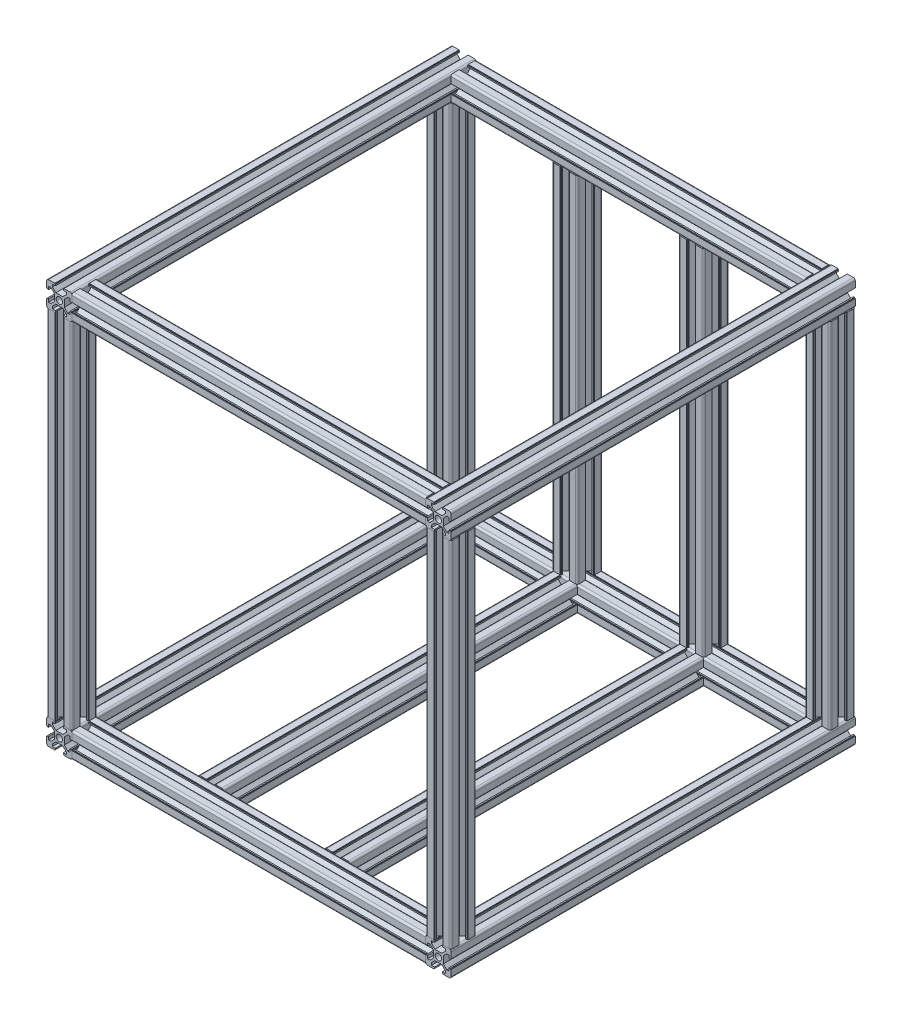
from build123d import *

# Parameters (mm, degrees)
F_20_X_20_X_R1_5_1_DEPTH      = 310
F_20_X_20_X_R1_5_1_DEPTH_BACK = 10
SKETCH11_R                    = 2.5
SKETCH11_ON_SEGMENT_2_R       = 2.5
F_20_X_20_X_R1_5_1_2_DEPTH    = 320
SKETCH11_ON_SEGMENT_3_R       = 2.5
F_20_X_20_X_R1_5_1_3_DEPTH    = 320
SKETCH11_ON_SEGMENT_4_R       = 2.5
F_20_X_20_X_R1_5_1_4_DEPTH    = 320
SKETCH11_ON_SEGMENT_5_R       = 2.5
F_20_X_20_X_R1_5_1_5_DEPTH    = 302
SKETCH11_ON_SEGMENT_6_R       = 2.5
F_20_X_20_X_R1_5_1_6_DEPTH    = 302
SKETCH11_ON_SEGMENT_7_R       = 2.5
F_20_X_20_X_R1_5_1_7_DEPTH    = 302
SKETCH11_ON_SEGMENT_8_R       = 2.5
F_20_X_20_X_R1_5_1_8_DEPTH    = 302
SKETCH11_ON_SEGMENT_9_R       = 2.5
F_20_X_20_X_R1_5_1_9_DEPTH    = 302
SKETCH11_ON_SEGMENT_10_R      = 2.5
F_20_X_20_X_R1_5_1_10_DEPTH   = 302
SKETCH11_ON_SEGMENT_11_R      = 2.5
F_20_X_20_X_R1_5_1_11_DEPTH   = 302
SKETCH11_ON_SEGMENT_12_R      = 2.5
F_20_X_20_X_R1_5_1_12_DEPTH   = 302
SKETCH1_R                     = 2.5
F_20_X_20_X_R1_5_3_DEPTH      = 300
SKETCH1_ON_SEGMENT_2_R        = 2.5
F_20_X_20_X_R1_5_3_2_DEPTH    = 300
SKETCH13_R                    = 2.5
F_20_X_20_X_R1_5_7_DEPTH      = 300
SKETCH13_ON_SEGMENT_2_R       = 2.5
F_20_X_20_X_R1_5_7_2_DEPTH    = 300


with BuildPart() as part:
    # Sketch11 → 铝型材 20 X 20 X R1.5(1) (new, two sides: drawn at the far end of the back side and taken through both)
    with BuildSketch(Plane(origin=(0, 300, -300), x_dir=(1, 0, 0), z_dir=(0, 0, 1)).offset(-F_20_X_20_X_R1_5_1_DEPTH_BACK)):
        with BuildLine():
            Line((-3.6, 10), (-3.6, 9.5))
            Line((-3.6, 9.5), (-3.1, 9.5))
            Line((-3.1, 9.5), (-3.1, 8.5))
            Line((-3.1, 8.5), (-5.5, 8.5))
            Line((-5.5, 8.5), (-5.5, 6.65))
            Line((-5.5, 6.65), (-2.75, 3.9))
            Line((-2.75, 3.9), (2.75, 3.9))
            Line((2.75, 3.9), (5.5, 6.65))
            Line((5.5, 6.65), (5.5, 8.5))
            Line((5.5, 8.5), (3.1, 8.5))
            Line((3.1, 8.5), (3.1, 9.5))
            Line((3.1, 9.5), (3.6, 9.5))
            Line((3.6, 9.5), (3.6, 10))
            Line((3.6, 10), (8.5, 10))
            ThreePointArc((8.5, 10), (9.560660172, 9.560660172), (10, 8.5))
            Line((10, 8.5), (10, 3.6))
            Line((10, 3.6), (9.5, 3.6))
            Line((9.5, 3.6), (9.5, 3.1))
            Line((9.5, 3.1), (8.5, 3.1))
            Line((8.5, 3.1), (8.5, 5.5))
            Line((8.5, 5.5), (6.65, 5.5))
            Line((6.65, 5.5), (3.9, 2.75))
            Line((3.9, 2.75), (3.9, -2.75))
            Line((3.9, -2.75), (6.65, -5.5))
            Line((6.65, -5.5), (8.5, -5.5))
            Line((8.5, -5.5), (8.5, -3.1))
            Line((8.5, -3.1), (9.5, -3.1))
            Line((9.5, -3.1), (9.5, -3.6))
            Line((9.5, -3.6), (10, -3.6))
            Line((10, -3.6), (10, -8.5))
            ThreePointArc((10, -8.5), (9.560660172, -9.560660172), (8.5, -10))
            Line((8.5, -10), (3.6, -10))
            Line((3.6, -10), (3.6, -9.5))
            Line((3.6, -9.5), (3.1, -9.5))
            Line((3.1, -9.5), (3.1, -8.5))
            Line((3.1, -8.5), (5.5, -8.5))
            Line((5.5, -8.5), (5.5, -6.65))
            Line((5.5, -6.65), (2.75, -3.9))
            Line((2.75, -3.9), (-2.75, -3.9))
            Line((-2.75, -3.9), (-5.5, -6.65))
            Line((-5.5, -6.65), (-5.5, -8.5))
            Line((-5.5, -8.5), (-3.1, -8.5))
            Line((-3.1, -8.5), (-3.1, -9.5))
            Line((-3.1, -9.5), (-3.6, -9.5))
            Line((-3.6, -9.5), (-3.6, -10))
            Line((-3.6, -10), (-8.5, -10))
            ThreePointArc((-8.5, -10), (-9.560660172, -9.560660172), (-10, -8.5))
            Line((-10, -8.5), (-10, -3.6))
            Line((-10, -3.6), (-9.5, -3.6))
            Line((-9.5, -3.6), (-9.5, -3.1))
            Line((-9.5, -3.1), (-8.5, -3.1))
            Line((-8.5, -3.1), (-8.5, -5.5))
            Line((-8.5, -5.5), (-6.65, -5.5))
            Line((-6.65, -5.5), (-3.9, -2.75))
            Line((-3.9, -2.75), (-3.9, 2.75))
            Line((-3.9, 2.75), (-6.65, 5.5))
            Line((-6.65, 5.5), (-8.5, 5.5))
            Line((-8.5, 5.5), (-8.5, 3.1))
            Line((-8.5, 3.1), (-9.5, 3.1))
            Line((-9.5, 3.1), (-9.5, 3.6))
            Line((-9.5, 3.6), (-10, 3.6))
            Line((-10, 3.6), (-10, 8.5))
            ThreePointArc((-10, 8.5), (-9.560660172, 9.560660172), (-8.5, 10))
            Line((-8.5, 10), (-3.6, 10))
        make_face()
        Circle(SKETCH11_R, mode=Mode.SUBTRACT)
    extrude(amount=F_20_X_20_X_R1_5_1_DEPTH + F_20_X_20_X_R1_5_1_DEPTH_BACK)


with BuildPart() as body_2:
    # Sketch11 on segment 2 (carried to segment 2) → 20 X 20 X R1.5_1 2 (new body)
    with BuildSketch(Plane(origin=(300, 0, -310), x_dir=(1, 0, 0), z_dir=(0, 0, 1))):
        with BuildLine():
            Line((-3.6, 10), (-3.6, 9.5))
            Line((-3.6, 9.5), (-3.1, 9.5))
            Line((-3.1, 9.5), (-3.1, 8.5))
            Line((-3.1, 8.5), (-5.5, 8.5))
            Line((-5.5, 8.5), (-5.5, 6.65))
            Line((-5.5, 6.65), (-2.75, 3.9))
            Line((-2.75, 3.9), (2.75, 3.9))
            Line((2.75, 3.9), (5.5, 6.65))
            Line((5.5, 6.65), (5.5, 8.5))
            Line((5.5, 8.5), (3.1, 8.5))
            Line((3.1, 8.5), (3.1, 9.5))
            Line((3.1, 9.5), (3.6, 9.5))
            Line((3.6, 9.5), (3.6, 10))
            Line((3.6, 10), (8.5, 10))
            ThreePointArc((8.5, 10), (9.560660172, 9.560660172), (10, 8.5))
            Line((10, 8.5), (10, 3.6))
            Line((10, 3.6), (9.5, 3.6))
            Line((9.5, 3.6), (9.5, 3.1))
            Line((9.5, 3.1), (8.5, 3.1))
            Line((8.5, 3.1), (8.5, 5.5))
            Line((8.5, 5.5), (6.65, 5.5))
            Line((6.65, 5.5), (3.9, 2.75))
            Line((3.9, 2.75), (3.9, -2.75))
            Line((3.9, -2.75), (6.65, -5.5))
            Line((6.65, -5.5), (8.5, -5.5))
            Line((8.5, -5.5), (8.5, -3.1))
            Line((8.5, -3.1), (9.5, -3.1))
            Line((9.5, -3.1), (9.5, -3.6))
            Line((9.5, -3.6), (10, -3.6))
            Line((10, -3.6), (10, -8.5))
            ThreePointArc((10, -8.5), (9.560660172, -9.560660172), (8.5, -10))
            Line((8.5, -10), (3.6, -10))
            Line((3.6, -10), (3.6, -9.5))
            Line((3.6, -9.5), (3.1, -9.5))
            Line((3.1, -9.5), (3.1, -8.5))
            Line((3.1, -8.5), (5.5, -8.5))
            Line((5.5, -8.5), (5.5, -6.65))
            Line((5.5, -6.65), (2.75, -3.9))
            Line((2.75, -3.9), (-2.75, -3.9))
            Line((-2.75, -3.9), (-5.5, -6.65))
            Line((-5.5, -6.65), (-5.5, -8.5))
            Line((-5.5, -8.5), (-3.1, -8.5))
            Line((-3.1, -8.5), (-3.1, -9.5))
            Line((-3.1, -9.5), (-3.6, -9.5))
            Line((-3.6, -9.5), (-3.6, -10))
            Line((-3.6, -10), (-8.5, -10))
            ThreePointArc((-8.5, -10), (-9.560660172, -9.560660172), (-10, -8.5))
            Line((-10, -8.5), (-10, -3.6))
            Line((-10, -3.6), (-9.5, -3.6))
            Line((-9.5, -3.6), (-9.5, -3.1))
            Line((-9.5, -3.1), (-8.5, -3.1))
            Line((-8.5, -3.1), (-8.5, -5.5))
            Line((-8.5, -5.5), (-6.65, -5.5))
            Line((-6.65, -5.5), (-3.9, -2.75))
            Line((-3.9, -2.75), (-3.9, 2.75))
            Line((-3.9, 2.75), (-6.65, 5.5))
            Line((-6.65, 5.5), (-8.5, 5.5))
            Line((-8.5, 5.5), (-8.5, 3.1))
            Line((-8.5, 3.1), (-9.5, 3.1))
            Line((-9.5, 3.1), (-9.5, 3.6))
            Line((-9.5, 3.6), (-10, 3.6))
            Line((-10, 3.6), (-10, 8.5))
            ThreePointArc((-10, 8.5), (-9.560660172, 9.560660172), (-8.5, 10))
            Line((-8.5, 10), (-3.6, 10))
        make_face()
        Circle(SKETCH11_ON_SEGMENT_2_R, mode=Mode.SUBTRACT)
    extrude(amount=F_20_X_20_X_R1_5_1_2_DEPTH)


with BuildPart() as body_3:
    # Sketch11 on segment 3 (carried to segment 3) → 20 X 20 X R1.5_1 3 (new body)
    with BuildSketch(Plane.XY.offset(-310)):
        with BuildLine():
            Line((-3.6, 10), (-3.6, 9.5))
            Line((-3.6, 9.5), (-3.1, 9.5))
            Line((-3.1, 9.5), (-3.1, 8.5))
            Line((-3.1, 8.5), (-5.5, 8.5))
            Line((-5.5, 8.5), (-5.5, 6.65))
            Line((-5.5, 6.65), (-2.75, 3.9))
            Line((-2.75, 3.9), (2.75, 3.9))
            Line((2.75, 3.9), (5.5, 6.65))
            Line((5.5, 6.65), (5.5, 8.5))
            Line((5.5, 8.5), (3.1, 8.5))
            Line((3.1, 8.5), (3.1, 9.5))
            Line((3.1, 9.5), (3.6, 9.5))
            Line((3.6, 9.5), (3.6, 10))
            Line((3.6, 10), (8.5, 10))
            ThreePointArc((8.5, 10), (9.560660172, 9.560660172), (10, 8.5))
            Line((10, 8.5), (10, 3.6))
            Line((10, 3.6), (9.5, 3.6))
            Line((9.5, 3.6), (9.5, 3.1))
            Line((9.5, 3.1), (8.5, 3.1))
            Line((8.5, 3.1), (8.5, 5.5))
            Line((8.5, 5.5), (6.65, 5.5))
            Line((6.65, 5.5), (3.9, 2.75))
            Line((3.9, 2.75), (3.9, -2.75))
            Line((3.9, -2.75), (6.65, -5.5))
            Line((6.65, -5.5), (8.5, -5.5))
            Line((8.5, -5.5), (8.5, -3.1))
            Line((8.5, -3.1), (9.5, -3.1))
            Line((9.5, -3.1), (9.5, -3.6))
            Line((9.5, -3.6), (10, -3.6))
            Line((10, -3.6), (10, -8.5))
            ThreePointArc((10, -8.5), (9.560660172, -9.560660172), (8.5, -10))
            Line((8.5, -10), (3.6, -10))
            Line((3.6, -10), (3.6, -9.5))
            Line((3.6, -9.5), (3.1, -9.5))
            Line((3.1, -9.5), (3.1, -8.5))
            Line((3.1, -8.5), (5.5, -8.5))
            Line((5.5, -8.5), (5.5, -6.65))
            Line((5.5, -6.65), (2.75, -3.9))
            Line((2.75, -3.9), (-2.75, -3.9))
            Line((-2.75, -3.9), (-5.5, -6.65))
            Line((-5.5, -6.65), (-5.5, -8.5))
            Line((-5.5, -8.5), (-3.1, -8.5))
            Line((-3.1, -8.5), (-3.1, -9.5))
            Line((-3.1, -9.5), (-3.6, -9.5))
            Line((-3.6, -9.5), (-3.6, -10))
            Line((-3.6, -10), (-8.5, -10))
            ThreePointArc((-8.5, -10), (-9.560660172, -9.560660172), (-10, -8.5))
            Line((-10, -8.5), (-10, -3.6))
            Line((-10, -3.6), (-9.5, -3.6))
            Line((-9.5, -3.6), (-9.5, -3.1))
            Line((-9.5, -3.1), (-8.5, -3.1))
            Line((-8.5, -3.1), (-8.5, -5.5))
            Line((-8.5, -5.5), (-6.65, -5.5))
            Line((-6.65, -5.5), (-3.9, -2.75))
            Line((-3.9, -2.75), (-3.9, 2.75))
            Line((-3.9, 2.75), (-6.65, 5.5))
            Line((-6.65, 5.5), (-8.5, 5.5))
            Line((-8.5, 5.5), (-8.5, 3.1))
            Line((-8.5, 3.1), (-9.5, 3.1))
            Line((-9.5, 3.1), (-9.5, 3.6))
            Line((-9.5, 3.6), (-10, 3.6))
            Line((-10, 3.6), (-10, 8.5))
            ThreePointArc((-10, 8.5), (-9.560660172, 9.560660172), (-8.5, 10))
            Line((-8.5, 10), (-3.6, 10))
        make_face()
        Circle(SKETCH11_ON_SEGMENT_3_R, mode=Mode.SUBTRACT)
    extrude(amount=F_20_X_20_X_R1_5_1_3_DEPTH)


with BuildPart() as body_4:
    # Sketch11 on segment 4 (carried to segment 4) → 20 X 20 X R1.5_1 4 (new body)
    with BuildSketch(Plane(origin=(300, 300, -310), x_dir=(1, 0, 0), z_dir=(0, 0, 1))):
        with BuildLine():
            Line((-3.6, 10), (-3.6, 9.5))
            Line((-3.6, 9.5), (-3.1, 9.5))
            Line((-3.1, 9.5), (-3.1, 8.5))
            Line((-3.1, 8.5), (-5.5, 8.5))
            Line((-5.5, 8.5), (-5.5, 6.65))
            Line((-5.5, 6.65), (-2.75, 3.9))
            Line((-2.75, 3.9), (2.75, 3.9))
            Line((2.75, 3.9), (5.5, 6.65))
            Line((5.5, 6.65), (5.5, 8.5))
            Line((5.5, 8.5), (3.1, 8.5))
            Line((3.1, 8.5), (3.1, 9.5))
            Line((3.1, 9.5), (3.6, 9.5))
            Line((3.6, 9.5), (3.6, 10))
            Line((3.6, 10), (8.5, 10))
            ThreePointArc((8.5, 10), (9.560660172, 9.560660172), (10, 8.5))
            Line((10, 8.5), (10, 3.6))
            Line((10, 3.6), (9.5, 3.6))
            Line((9.5, 3.6), (9.5, 3.1))
            Line((9.5, 3.1), (8.5, 3.1))
            Line((8.5, 3.1), (8.5, 5.5))
            Line((8.5, 5.5), (6.65, 5.5))
            Line((6.65, 5.5), (3.9, 2.75))
            Line((3.9, 2.75), (3.9, -2.75))
            Line((3.9, -2.75), (6.65, -5.5))
            Line((6.65, -5.5), (8.5, -5.5))
            Line((8.5, -5.5), (8.5, -3.1))
            Line((8.5, -3.1), (9.5, -3.1))
            Line((9.5, -3.1), (9.5, -3.6))
            Line((9.5, -3.6), (10, -3.6))
            Line((10, -3.6), (10, -8.5))
            ThreePointArc((10, -8.5), (9.560660172, -9.560660172), (8.5, -10))
            Line((8.5, -10), (3.6, -10))
            Line((3.6, -10), (3.6, -9.5))
            Line((3.6, -9.5), (3.1, -9.5))
            Line((3.1, -9.5), (3.1, -8.5))
            Line((3.1, -8.5), (5.5, -8.5))
            Line((5.5, -8.5), (5.5, -6.65))
            Line((5.5, -6.65), (2.75, -3.9))
            Line((2.75, -3.9), (-2.75, -3.9))
            Line((-2.75, -3.9), (-5.5, -6.65))
            Line((-5.5, -6.65), (-5.5, -8.5))
            Line((-5.5, -8.5), (-3.1, -8.5))
            Line((-3.1, -8.5), (-3.1, -9.5))
            Line((-3.1, -9.5), (-3.6, -9.5))
            Line((-3.6, -9.5), (-3.6, -10))
            Line((-3.6, -10), (-8.5, -10))
            ThreePointArc((-8.5, -10), (-9.560660172, -9.560660172), (-10, -8.5))
            Line((-10, -8.5), (-10, -3.6))
            Line((-10, -3.6), (-9.5, -3.6))
            Line((-9.5, -3.6), (-9.5, -3.1))
            Line((-9.5, -3.1), (-8.5, -3.1))
            Line((-8.5, -3.1), (-8.5, -5.5))
            Line((-8.5, -5.5), (-6.65, -5.5))
            Line((-6.65, -5.5), (-3.9, -2.75))
            Line((-3.9, -2.75), (-3.9, 2.75))
            Line((-3.9, 2.75), (-6.65, 5.5))
            Line((-6.65, 5.5), (-8.5, 5.5))
            Line((-8.5, 5.5), (-8.5, 3.1))
            Line((-8.5, 3.1), (-9.5, 3.1))
            Line((-9.5, 3.1), (-9.5, 3.6))
            Line((-9.5, 3.6), (-10, 3.6))
            Line((-10, 3.6), (-10, 8.5))
            ThreePointArc((-10, 8.5), (-9.560660172, 9.560660172), (-8.5, 10))
            Line((-8.5, 10), (-3.6, 10))
        make_face()
        Circle(SKETCH11_ON_SEGMENT_4_R, mode=Mode.SUBTRACT)
    extrude(amount=F_20_X_20_X_R1_5_1_4_DEPTH)


with BuildPart() as body_5:
    # Sketch11 on segment 5 (carried to segment 5) → 20 X 20 X R1.5_1 5 (new body)
    with BuildSketch(Plane(origin=(300, -1, 0), x_dir=(1, 0, 0), z_dir=(0, 1, 0))):
        with BuildLine():
            Line((-3.6, 10), (-3.6, 9.5))
            Line((-3.6, 9.5), (-3.1, 9.5))
            Line((-3.1, 9.5), (-3.1, 8.5))
            Line((-3.1, 8.5), (-5.5, 8.5))
            Line((-5.5, 8.5), (-5.5, 6.65))
            Line((-5.5, 6.65), (-2.75, 3.9))
            Line((-2.75, 3.9), (2.75, 3.9))
            Line((2.75, 3.9), (5.5, 6.65))
            Line((5.5, 6.65), (5.5, 8.5))
            Line((5.5, 8.5), (3.1, 8.5))
            Line((3.1, 8.5), (3.1, 9.5))
            Line((3.1, 9.5), (3.6, 9.5))
            Line((3.6, 9.5), (3.6, 10))
            Line((3.6, 10), (8.5, 10))
            ThreePointArc((8.5, 10), (9.560660172, 9.560660172), (10, 8.5))
            Line((10, 8.5), (10, 3.6))
            Line((10, 3.6), (9.5, 3.6))
            Line((9.5, 3.6), (9.5, 3.1))
            Line((9.5, 3.1), (8.5, 3.1))
            Line((8.5, 3.1), (8.5, 5.5))
            Line((8.5, 5.5), (6.65, 5.5))
            Line((6.65, 5.5), (3.9, 2.75))
            Line((3.9, 2.75), (3.9, -2.75))
            Line((3.9, -2.75), (6.65, -5.5))
            Line((6.65, -5.5), (8.5, -5.5))
            Line((8.5, -5.5), (8.5, -3.1))
            Line((8.5, -3.1), (9.5, -3.1))
            Line((9.5, -3.1), (9.5, -3.6))
            Line((9.5, -3.6), (10, -3.6))
            Line((10, -3.6), (10, -8.5))
            ThreePointArc((10, -8.5), (9.560660172, -9.560660172), (8.5, -10))
            Line((8.5, -10), (3.6, -10))
            Line((3.6, -10), (3.6, -9.5))
            Line((3.6, -9.5), (3.1, -9.5))
            Line((3.1, -9.5), (3.1, -8.5))
            Line((3.1, -8.5), (5.5, -8.5))
            Line((5.5, -8.5), (5.5, -6.65))
            Line((5.5, -6.65), (2.75, -3.9))
            Line((2.75, -3.9), (-2.75, -3.9))
            Line((-2.75, -3.9), (-5.5, -6.65))
            Line((-5.5, -6.65), (-5.5, -8.5))
            Line((-5.5, -8.5), (-3.1, -8.5))
            Line((-3.1, -8.5), (-3.1, -9.5))
            Line((-3.1, -9.5), (-3.6, -9.5))
            Line((-3.6, -9.5), (-3.6, -10))
            Line((-3.6, -10), (-8.5, -10))
            ThreePointArc((-8.5, -10), (-9.560660172, -9.560660172), (-10, -8.5))
            Line((-10, -8.5), (-10, -3.6))
            Line((-10, -3.6), (-9.5, -3.6))
            Line((-9.5, -3.6), (-9.5, -3.1))
            Line((-9.5, -3.1), (-8.5, -3.1))
            Line((-8.5, -3.1), (-8.5, -5.5))
            Line((-8.5, -5.5), (-6.65, -5.5))
            Line((-6.65, -5.5), (-3.9, -2.75))
            Line((-3.9, -2.75), (-3.9, 2.75))
            Line((-3.9, 2.75), (-6.65, 5.5))
            Line((-6.65, 5.5), (-8.5, 5.5))
            Line((-8.5, 5.5), (-8.5, 3.1))
            Line((-8.5, 3.1), (-9.5, 3.1))
            Line((-9.5, 3.1), (-9.5, 3.6))
            Line((-9.5, 3.6), (-10, 3.6))
            Line((-10, 3.6), (-10, 8.5))
            ThreePointArc((-10, 8.5), (-9.560660172, 9.560660172), (-8.5, 10))
            Line((-8.5, 10), (-3.6, 10))
        make_face()
        Circle(SKETCH11_ON_SEGMENT_5_R, mode=Mode.SUBTRACT)
    extrude(amount=F_20_X_20_X_R1_5_1_5_DEPTH)

    # 20 X 20 X R1.5_1 5 end butt 1
    split(bisect_by=Plane(origin=(300, 10, 0), x_dir=(-1, 0, 0), z_dir=(0, 1, 0)), keep=Keep.TOP)

    # 20 X 20 X R1.5_1 5 end butt 2
    split(bisect_by=Plane(origin=(300, 290, 0), x_dir=(1, 0, 0), z_dir=(0, -1, 0)), keep=Keep.TOP)


with BuildPart() as body_6:
    # Sketch11 on segment 6 (carried to segment 6) → 20 X 20 X R1.5_1 6 (new body)
    with BuildSketch(Plane(origin=(-1, 0, 0), x_dir=(0, 0, -1), z_dir=(1, 0, 0))):
        with BuildLine():
            Line((-3.6, 10), (-3.6, 9.5))
            Line((-3.6, 9.5), (-3.1, 9.5))
            Line((-3.1, 9.5), (-3.1, 8.5))
            Line((-3.1, 8.5), (-5.5, 8.5))
            Line((-5.5, 8.5), (-5.5, 6.65))
            Line((-5.5, 6.65), (-2.75, 3.9))
            Line((-2.75, 3.9), (2.75, 3.9))
            Line((2.75, 3.9), (5.5, 6.65))
            Line((5.5, 6.65), (5.5, 8.5))
            Line((5.5, 8.5), (3.1, 8.5))
            Line((3.1, 8.5), (3.1, 9.5))
            Line((3.1, 9.5), (3.6, 9.5))
            Line((3.6, 9.5), (3.6, 10))
            Line((3.6, 10), (8.5, 10))
            ThreePointArc((8.5, 10), (9.560660172, 9.560660172), (10, 8.5))
            Line((10, 8.5), (10, 3.6))
            Line((10, 3.6), (9.5, 3.6))
            Line((9.5, 3.6), (9.5, 3.1))
            Line((9.5, 3.1), (8.5, 3.1))
            Line((8.5, 3.1), (8.5, 5.5))
            Line((8.5, 5.5), (6.65, 5.5))
            Line((6.65, 5.5), (3.9, 2.75))
            Line((3.9, 2.75), (3.9, -2.75))
            Line((3.9, -2.75), (6.65, -5.5))
            Line((6.65, -5.5), (8.5, -5.5))
            Line((8.5, -5.5), (8.5, -3.1))
            Line((8.5, -3.1), (9.5, -3.1))
            Line((9.5, -3.1), (9.5, -3.6))
            Line((9.5, -3.6), (10, -3.6))
            Line((10, -3.6), (10, -8.5))
            ThreePointArc((10, -8.5), (9.560660172, -9.560660172), (8.5, -10))
            Line((8.5, -10), (3.6, -10))
            Line((3.6, -10), (3.6, -9.5))
            Line((3.6, -9.5), (3.1, -9.5))
            Line((3.1, -9.5), (3.1, -8.5))
            Line((3.1, -8.5), (5.5, -8.5))
            Line((5.5, -8.5), (5.5, -6.65))
            Line((5.5, -6.65), (2.75, -3.9))
            Line((2.75, -3.9), (-2.75, -3.9))
            Line((-2.75, -3.9), (-5.5, -6.65))
            Line((-5.5, -6.65), (-5.5, -8.5))
            Line((-5.5, -8.5), (-3.1, -8.5))
            Line((-3.1, -8.5), (-3.1, -9.5))
            Line((-3.1, -9.5), (-3.6, -9.5))
            Line((-3.6, -9.5), (-3.6, -10))
            Line((-3.6, -10), (-8.5, -10))
            ThreePointArc((-8.5, -10), (-9.560660172, -9.560660172), (-10, -8.5))
            Line((-10, -8.5), (-10, -3.6))
            Line((-10, -3.6), (-9.5, -3.6))
            Line((-9.5, -3.6), (-9.5, -3.1))
            Line((-9.5, -3.1), (-8.5, -3.1))
            Line((-8.5, -3.1), (-8.5, -5.5))
            Line((-8.5, -5.5), (-6.65, -5.5))
            Line((-6.65, -5.5), (-3.9, -2.75))
            Line((-3.9, -2.75), (-3.9, 2.75))
            Line((-3.9, 2.75), (-6.65, 5.5))
            Line((-6.65, 5.5), (-8.5, 5.5))
            Line((-8.5, 5.5), (-8.5, 3.1))
            Line((-8.5, 3.1), (-9.5, 3.1))
            Line((-9.5, 3.1), (-9.5, 3.6))
            Line((-9.5, 3.6), (-10, 3.6))
            Line((-10, 3.6), (-10, 8.5))
            ThreePointArc((-10, 8.5), (-9.560660172, 9.560660172), (-8.5, 10))
            Line((-8.5, 10), (-3.6, 10))
        make_face()
        Circle(SKETCH11_ON_SEGMENT_6_R, mode=Mode.SUBTRACT)
    extrude(amount=F_20_X_20_X_R1_5_1_6_DEPTH)

    # 20 X 20 X R1.5_1 6 end butt 1
    split(bisect_by=Plane.YZ.offset(10), keep=Keep.TOP)

    # 20 X 20 X R1.5_1 6 end butt 2
    split(bisect_by=Plane(origin=(290, 0, 0), x_dir=(0, -1, 0), z_dir=(-1, 0, 0)), keep=Keep.TOP)


with BuildPart() as body_7:
    # Sketch11 on segment 7 (carried to segment 7) → 20 X 20 X R1.5_1 7 (new body)
    with BuildSketch(Plane.XZ.offset(-301)):
        with BuildLine():
            Line((-3.6, 10), (-3.6, 9.5))
            Line((-3.6, 9.5), (-3.1, 9.5))
            Line((-3.1, 9.5), (-3.1, 8.5))
            Line((-3.1, 8.5), (-5.5, 8.5))
            Line((-5.5, 8.5), (-5.5, 6.65))
            Line((-5.5, 6.65), (-2.75, 3.9))
            Line((-2.75, 3.9), (2.75, 3.9))
            Line((2.75, 3.9), (5.5, 6.65))
            Line((5.5, 6.65), (5.5, 8.5))
            Line((5.5, 8.5), (3.1, 8.5))
            Line((3.1, 8.5), (3.1, 9.5))
            Line((3.1, 9.5), (3.6, 9.5))
            Line((3.6, 9.5), (3.6, 10))
            Line((3.6, 10), (8.5, 10))
            ThreePointArc((8.5, 10), (9.560660172, 9.560660172), (10, 8.5))
            Line((10, 8.5), (10, 3.6))
            Line((10, 3.6), (9.5, 3.6))
            Line((9.5, 3.6), (9.5, 3.1))
            Line((9.5, 3.1), (8.5, 3.1))
            Line((8.5, 3.1), (8.5, 5.5))
            Line((8.5, 5.5), (6.65, 5.5))
            Line((6.65, 5.5), (3.9, 2.75))
            Line((3.9, 2.75), (3.9, -2.75))
            Line((3.9, -2.75), (6.65, -5.5))
            Line((6.65, -5.5), (8.5, -5.5))
            Line((8.5, -5.5), (8.5, -3.1))
            Line((8.5, -3.1), (9.5, -3.1))
            Line((9.5, -3.1), (9.5, -3.6))
            Line((9.5, -3.6), (10, -3.6))
            Line((10, -3.6), (10, -8.5))
            ThreePointArc((10, -8.5), (9.560660172, -9.560660172), (8.5, -10))
            Line((8.5, -10), (3.6, -10))
            Line((3.6, -10), (3.6, -9.5))
            Line((3.6, -9.5), (3.1, -9.5))
            Line((3.1, -9.5), (3.1, -8.5))
            Line((3.1, -8.5), (5.5, -8.5))
            Line((5.5, -8.5), (5.5, -6.65))
            Line((5.5, -6.65), (2.75, -3.9))
            Line((2.75, -3.9), (-2.75, -3.9))
            Line((-2.75, -3.9), (-5.5, -6.65))
            Line((-5.5, -6.65), (-5.5, -8.5))
            Line((-5.5, -8.5), (-3.1, -8.5))
            Line((-3.1, -8.5), (-3.1, -9.5))
            Line((-3.1, -9.5), (-3.6, -9.5))
            Line((-3.6, -9.5), (-3.6, -10))
            Line((-3.6, -10), (-8.5, -10))
            ThreePointArc((-8.5, -10), (-9.560660172, -9.560660172), (-10, -8.5))
            Line((-10, -8.5), (-10, -3.6))
            Line((-10, -3.6), (-9.5, -3.6))
            Line((-9.5, -3.6), (-9.5, -3.1))
            Line((-9.5, -3.1), (-8.5, -3.1))
            Line((-8.5, -3.1), (-8.5, -5.5))
            Line((-8.5, -5.5), (-6.65, -5.5))
            Line((-6.65, -5.5), (-3.9, -2.75))
            Line((-3.9, -2.75), (-3.9, 2.75))
            Line((-3.9, 2.75), (-6.65, 5.5))
            Line((-6.65, 5.5), (-8.5, 5.5))
            Line((-8.5, 5.5), (-8.5, 3.1))
            Line((-8.5, 3.1), (-9.5, 3.1))
            Line((-9.5, 3.1), (-9.5, 3.6))
            Line((-9.5, 3.6), (-10, 3.6))
            Line((-10, 3.6), (-10, 8.5))
            ThreePointArc((-10, 8.5), (-9.560660172, 9.560660172), (-8.5, 10))
            Line((-8.5, 10), (-3.6, 10))
        make_face()
        Circle(SKETCH11_ON_SEGMENT_7_R, mode=Mode.SUBTRACT)
    extrude(amount=F_20_X_20_X_R1_5_1_7_DEPTH)

    # 20 X 20 X R1.5_1 7 end butt 1
    split(bisect_by=Plane.XZ.offset(-290), keep=Keep.TOP)

    # 20 X 20 X R1.5_1 7 end butt 2
    split(bisect_by=Plane(origin=(0, 10, 0), x_dir=(-1, 0, 0), z_dir=(0, 1, 0)), keep=Keep.TOP)


with BuildPart() as body_8:
    # Sketch11 on segment 8 (carried to segment 8) → 20 X 20 X R1.5_1 8 (new body)
    with BuildSketch(Plane(origin=(301, 300, 0), x_dir=(0, 0, 1), z_dir=(-1, 0, 0))):
        with BuildLine():
            Line((-3.6, 10), (-3.6, 9.5))
            Line((-3.6, 9.5), (-3.1, 9.5))
            Line((-3.1, 9.5), (-3.1, 8.5))
            Line((-3.1, 8.5), (-5.5, 8.5))
            Line((-5.5, 8.5), (-5.5, 6.65))
            Line((-5.5, 6.65), (-2.75, 3.9))
            Line((-2.75, 3.9), (2.75, 3.9))
            Line((2.75, 3.9), (5.5, 6.65))
            Line((5.5, 6.65), (5.5, 8.5))
            Line((5.5, 8.5), (3.1, 8.5))
            Line((3.1, 8.5), (3.1, 9.5))
            Line((3.1, 9.5), (3.6, 9.5))
            Line((3.6, 9.5), (3.6, 10))
            Line((3.6, 10), (8.5, 10))
            ThreePointArc((8.5, 10), (9.560660172, 9.560660172), (10, 8.5))
            Line((10, 8.5), (10, 3.6))
            Line((10, 3.6), (9.5, 3.6))
            Line((9.5, 3.6), (9.5, 3.1))
            Line((9.5, 3.1), (8.5, 3.1))
            Line((8.5, 3.1), (8.5, 5.5))
            Line((8.5, 5.5), (6.65, 5.5))
            Line((6.65, 5.5), (3.9, 2.75))
            Line((3.9, 2.75), (3.9, -2.75))
            Line((3.9, -2.75), (6.65, -5.5))
            Line((6.65, -5.5), (8.5, -5.5))
            Line((8.5, -5.5), (8.5, -3.1))
            Line((8.5, -3.1), (9.5, -3.1))
            Line((9.5, -3.1), (9.5, -3.6))
            Line((9.5, -3.6), (10, -3.6))
            Line((10, -3.6), (10, -8.5))
            ThreePointArc((10, -8.5), (9.560660172, -9.560660172), (8.5, -10))
            Line((8.5, -10), (3.6, -10))
            Line((3.6, -10), (3.6, -9.5))
            Line((3.6, -9.5), (3.1, -9.5))
            Line((3.1, -9.5), (3.1, -8.5))
            Line((3.1, -8.5), (5.5, -8.5))
            Line((5.5, -8.5), (5.5, -6.65))
            Line((5.5, -6.65), (2.75, -3.9))
            Line((2.75, -3.9), (-2.75, -3.9))
            Line((-2.75, -3.9), (-5.5, -6.65))
            Line((-5.5, -6.65), (-5.5, -8.5))
            Line((-5.5, -8.5), (-3.1, -8.5))
            Line((-3.1, -8.5), (-3.1, -9.5))
            Line((-3.1, -9.5), (-3.6, -9.5))
            Line((-3.6, -9.5), (-3.6, -10))
            Line((-3.6, -10), (-8.5, -10))
            ThreePointArc((-8.5, -10), (-9.560660172, -9.560660172), (-10, -8.5))
            Line((-10, -8.5), (-10, -3.6))
            Line((-10, -3.6), (-9.5, -3.6))
            Line((-9.5, -3.6), (-9.5, -3.1))
            Line((-9.5, -3.1), (-8.5, -3.1))
            Line((-8.5, -3.1), (-8.5, -5.5))
            Line((-8.5, -5.5), (-6.65, -5.5))
            Line((-6.65, -5.5), (-3.9, -2.75))
            Line((-3.9, -2.75), (-3.9, 2.75))
            Line((-3.9, 2.75), (-6.65, 5.5))
            Line((-6.65, 5.5), (-8.5, 5.5))
            Line((-8.5, 5.5), (-8.5, 3.1))
            Line((-8.5, 3.1), (-9.5, 3.1))
            Line((-9.5, 3.1), (-9.5, 3.6))
            Line((-9.5, 3.6), (-10, 3.6))
            Line((-10, 3.6), (-10, 8.5))
            ThreePointArc((-10, 8.5), (-9.560660172, 9.560660172), (-8.5, 10))
            Line((-8.5, 10), (-3.6, 10))
        make_face()
        Circle(SKETCH11_ON_SEGMENT_8_R, mode=Mode.SUBTRACT)
    extrude(amount=F_20_X_20_X_R1_5_1_8_DEPTH)

    # 20 X 20 X R1.5_1 8 end butt 1
    split(bisect_by=Plane(origin=(290, 300, 0), x_dir=(0, -1, 0), z_dir=(-1, 0, 0)), keep=Keep.TOP)

    # 20 X 20 X R1.5_1 8 end butt 2
    split(bisect_by=Plane(origin=(10, 300, 0), x_dir=(0, 1, 0), z_dir=(1, 0, 0)), keep=Keep.TOP)


with BuildPart() as body_9:
    # Sketch11 on segment 9 (carried to segment 9) → 20 X 20 X R1.5_1 9 (new body)
    with BuildSketch(Plane(origin=(300, -1, -300), x_dir=(1, 0, 0), z_dir=(0, 1, 0))):
        with BuildLine():
            Line((-3.6, 10), (-3.6, 9.5))
            Line((-3.6, 9.5), (-3.1, 9.5))
            Line((-3.1, 9.5), (-3.1, 8.5))
            Line((-3.1, 8.5), (-5.5, 8.5))
            Line((-5.5, 8.5), (-5.5, 6.65))
            Line((-5.5, 6.65), (-2.75, 3.9))
            Line((-2.75, 3.9), (2.75, 3.9))
            Line((2.75, 3.9), (5.5, 6.65))
            Line((5.5, 6.65), (5.5, 8.5))
            Line((5.5, 8.5), (3.1, 8.5))
            Line((3.1, 8.5), (3.1, 9.5))
            Line((3.1, 9.5), (3.6, 9.5))
            Line((3.6, 9.5), (3.6, 10))
            Line((3.6, 10), (8.5, 10))
            ThreePointArc((8.5, 10), (9.560660172, 9.560660172), (10, 8.5))
            Line((10, 8.5), (10, 3.6))
            Line((10, 3.6), (9.5, 3.6))
            Line((9.5, 3.6), (9.5, 3.1))
            Line((9.5, 3.1), (8.5, 3.1))
            Line((8.5, 3.1), (8.5, 5.5))
            Line((8.5, 5.5), (6.65, 5.5))
            Line((6.65, 5.5), (3.9, 2.75))
            Line((3.9, 2.75), (3.9, -2.75))
            Line((3.9, -2.75), (6.65, -5.5))
            Line((6.65, -5.5), (8.5, -5.5))
            Line((8.5, -5.5), (8.5, -3.1))
            Line((8.5, -3.1), (9.5, -3.1))
            Line((9.5, -3.1), (9.5, -3.6))
            Line((9.5, -3.6), (10, -3.6))
            Line((10, -3.6), (10, -8.5))
            ThreePointArc((10, -8.5), (9.560660172, -9.560660172), (8.5, -10))
            Line((8.5, -10), (3.6, -10))
            Line((3.6, -10), (3.6, -9.5))
            Line((3.6, -9.5), (3.1, -9.5))
            Line((3.1, -9.5), (3.1, -8.5))
            Line((3.1, -8.5), (5.5, -8.5))
            Line((5.5, -8.5), (5.5, -6.65))
            Line((5.5, -6.65), (2.75, -3.9))
            Line((2.75, -3.9), (-2.75, -3.9))
            Line((-2.75, -3.9), (-5.5, -6.65))
            Line((-5.5, -6.65), (-5.5, -8.5))
            Line((-5.5, -8.5), (-3.1, -8.5))
            Line((-3.1, -8.5), (-3.1, -9.5))
            Line((-3.1, -9.5), (-3.6, -9.5))
            Line((-3.6, -9.5), (-3.6, -10))
            Line((-3.6, -10), (-8.5, -10))
            ThreePointArc((-8.5, -10), (-9.560660172, -9.560660172), (-10, -8.5))
            Line((-10, -8.5), (-10, -3.6))
            Line((-10, -3.6), (-9.5, -3.6))
            Line((-9.5, -3.6), (-9.5, -3.1))
            Line((-9.5, -3.1), (-8.5, -3.1))
            Line((-8.5, -3.1), (-8.5, -5.5))
            Line((-8.5, -5.5), (-6.65, -5.5))
            Line((-6.65, -5.5), (-3.9, -2.75))
            Line((-3.9, -2.75), (-3.9, 2.75))
            Line((-3.9, 2.75), (-6.65, 5.5))
            Line((-6.65, 5.5), (-8.5, 5.5))
            Line((-8.5, 5.5), (-8.5, 3.1))
            Line((-8.5, 3.1), (-9.5, 3.1))
            Line((-9.5, 3.1), (-9.5, 3.6))
            Line((-9.5, 3.6), (-10, 3.6))
            Line((-10, 3.6), (-10, 8.5))
            ThreePointArc((-10, 8.5), (-9.560660172, 9.560660172), (-8.5, 10))
            Line((-8.5, 10), (-3.6, 10))
        make_face()
        Circle(SKETCH11_ON_SEGMENT_9_R, mode=Mode.SUBTRACT)
    extrude(amount=F_20_X_20_X_R1_5_1_9_DEPTH)

    # 20 X 20 X R1.5_1 9 end butt 1
    split(bisect_by=Plane(origin=(300, 10, -300), x_dir=(-1, 0, 0), z_dir=(0, 1, 0)), keep=Keep.TOP)

    # 20 X 20 X R1.5_1 9 end butt 2
    split(bisect_by=Plane(origin=(300, 290, -300), x_dir=(1, 0, 0), z_dir=(0, -1, 0)), keep=Keep.TOP)


with BuildPart() as body_10:
    # Sketch11 on segment 10 (carried to segment 10) → 20 X 20 X R1.5_1 10 (new body)
    with BuildSketch(Plane(origin=(301, 300, -300), x_dir=(0, 0, 1), z_dir=(-1, 0, 0))):
        with BuildLine():
            Line((-3.6, 10), (-3.6, 9.5))
            Line((-3.6, 9.5), (-3.1, 9.5))
            Line((-3.1, 9.5), (-3.1, 8.5))
            Line((-3.1, 8.5), (-5.5, 8.5))
            Line((-5.5, 8.5), (-5.5, 6.65))
            Line((-5.5, 6.65), (-2.75, 3.9))
            Line((-2.75, 3.9), (2.75, 3.9))
            Line((2.75, 3.9), (5.5, 6.65))
            Line((5.5, 6.65), (5.5, 8.5))
            Line((5.5, 8.5), (3.1, 8.5))
            Line((3.1, 8.5), (3.1, 9.5))
            Line((3.1, 9.5), (3.6, 9.5))
            Line((3.6, 9.5), (3.6, 10))
            Line((3.6, 10), (8.5, 10))
            ThreePointArc((8.5, 10), (9.560660172, 9.560660172), (10, 8.5))
            Line((10, 8.5), (10, 3.6))
            Line((10, 3.6), (9.5, 3.6))
            Line((9.5, 3.6), (9.5, 3.1))
            Line((9.5, 3.1), (8.5, 3.1))
            Line((8.5, 3.1), (8.5, 5.5))
            Line((8.5, 5.5), (6.65, 5.5))
            Line((6.65, 5.5), (3.9, 2.75))
            Line((3.9, 2.75), (3.9, -2.75))
            Line((3.9, -2.75), (6.65, -5.5))
            Line((6.65, -5.5), (8.5, -5.5))
            Line((8.5, -5.5), (8.5, -3.1))
            Line((8.5, -3.1), (9.5, -3.1))
            Line((9.5, -3.1), (9.5, -3.6))
            Line((9.5, -3.6), (10, -3.6))
            Line((10, -3.6), (10, -8.5))
            ThreePointArc((10, -8.5), (9.560660172, -9.560660172), (8.5, -10))
            Line((8.5, -10), (3.6, -10))
            Line((3.6, -10), (3.6, -9.5))
            Line((3.6, -9.5), (3.1, -9.5))
            Line((3.1, -9.5), (3.1, -8.5))
            Line((3.1, -8.5), (5.5, -8.5))
            Line((5.5, -8.5), (5.5, -6.65))
            Line((5.5, -6.65), (2.75, -3.9))
            Line((2.75, -3.9), (-2.75, -3.9))
            Line((-2.75, -3.9), (-5.5, -6.65))
            Line((-5.5, -6.65), (-5.5, -8.5))
            Line((-5.5, -8.5), (-3.1, -8.5))
            Line((-3.1, -8.5), (-3.1, -9.5))
            Line((-3.1, -9.5), (-3.6, -9.5))
            Line((-3.6, -9.5), (-3.6, -10))
            Line((-3.6, -10), (-8.5, -10))
            ThreePointArc((-8.5, -10), (-9.560660172, -9.560660172), (-10, -8.5))
            Line((-10, -8.5), (-10, -3.6))
            Line((-10, -3.6), (-9.5, -3.6))
            Line((-9.5, -3.6), (-9.5, -3.1))
            Line((-9.5, -3.1), (-8.5, -3.1))
            Line((-8.5, -3.1), (-8.5, -5.5))
            Line((-8.5, -5.5), (-6.65, -5.5))
            Line((-6.65, -5.5), (-3.9, -2.75))
            Line((-3.9, -2.75), (-3.9, 2.75))
            Line((-3.9, 2.75), (-6.65, 5.5))
            Line((-6.65, 5.5), (-8.5, 5.5))
            Line((-8.5, 5.5), (-8.5, 3.1))
            Line((-8.5, 3.1), (-9.5, 3.1))
            Line((-9.5, 3.1), (-9.5, 3.6))
            Line((-9.5, 3.6), (-10, 3.6))
            Line((-10, 3.6), (-10, 8.5))
            ThreePointArc((-10, 8.5), (-9.560660172, 9.560660172), (-8.5, 10))
            Line((-8.5, 10), (-3.6, 10))
        make_face()
        Circle(SKETCH11_ON_SEGMENT_10_R, mode=Mode.SUBTRACT)
    extrude(amount=F_20_X_20_X_R1_5_1_10_DEPTH)

    # 20 X 20 X R1.5_1 10 end butt 1
    split(bisect_by=Plane(origin=(290, 300, -300), x_dir=(0, -1, 0), z_dir=(-1, 0, 0)), keep=Keep.TOP)

    # 20 X 20 X R1.5_1 10 end butt 2
    split(bisect_by=Plane(origin=(10, 300, -300), x_dir=(0, 1, 0), z_dir=(1, 0, 0)), keep=Keep.TOP)


with BuildPart() as body_11:
    # Sketch11 on segment 11 (carried to segment 11) → 20 X 20 X R1.5_1 11 (new body)
    with BuildSketch(Plane(origin=(0, 301, -300), x_dir=(1, 0, 0), z_dir=(0, -1, 0))):
        with BuildLine():
            Line((-3.6, 10), (-3.6, 9.5))
            Line((-3.6, 9.5), (-3.1, 9.5))
            Line((-3.1, 9.5), (-3.1, 8.5))
            Line((-3.1, 8.5), (-5.5, 8.5))
            Line((-5.5, 8.5), (-5.5, 6.65))
            Line((-5.5, 6.65), (-2.75, 3.9))
            Line((-2.75, 3.9), (2.75, 3.9))
            Line((2.75, 3.9), (5.5, 6.65))
            Line((5.5, 6.65), (5.5, 8.5))
            Line((5.5, 8.5), (3.1, 8.5))
            Line((3.1, 8.5), (3.1, 9.5))
            Line((3.1, 9.5), (3.6, 9.5))
            Line((3.6, 9.5), (3.6, 10))
            Line((3.6, 10), (8.5, 10))
            ThreePointArc((8.5, 10), (9.560660172, 9.560660172), (10, 8.5))
            Line((10, 8.5), (10, 3.6))
            Line((10, 3.6), (9.5, 3.6))
            Line((9.5, 3.6), (9.5, 3.1))
            Line((9.5, 3.1), (8.5, 3.1))
            Line((8.5, 3.1), (8.5, 5.5))
            Line((8.5, 5.5), (6.65, 5.5))
            Line((6.65, 5.5), (3.9, 2.75))
            Line((3.9, 2.75), (3.9, -2.75))
            Line((3.9, -2.75), (6.65, -5.5))
            Line((6.65, -5.5), (8.5, -5.5))
            Line((8.5, -5.5), (8.5, -3.1))
            Line((8.5, -3.1), (9.5, -3.1))
            Line((9.5, -3.1), (9.5, -3.6))
            Line((9.5, -3.6), (10, -3.6))
            Line((10, -3.6), (10, -8.5))
            ThreePointArc((10, -8.5), (9.560660172, -9.560660172), (8.5, -10))
            Line((8.5, -10), (3.6, -10))
            Line((3.6, -10), (3.6, -9.5))
            Line((3.6, -9.5), (3.1, -9.5))
            Line((3.1, -9.5), (3.1, -8.5))
            Line((3.1, -8.5), (5.5, -8.5))
            Line((5.5, -8.5), (5.5, -6.65))
            Line((5.5, -6.65), (2.75, -3.9))
            Line((2.75, -3.9), (-2.75, -3.9))
            Line((-2.75, -3.9), (-5.5, -6.65))
            Line((-5.5, -6.65), (-5.5, -8.5))
            Line((-5.5, -8.5), (-3.1, -8.5))
            Line((-3.1, -8.5), (-3.1, -9.5))
            Line((-3.1, -9.5), (-3.6, -9.5))
            Line((-3.6, -9.5), (-3.6, -10))
            Line((-3.6, -10), (-8.5, -10))
            ThreePointArc((-8.5, -10), (-9.560660172, -9.560660172), (-10, -8.5))
            Line((-10, -8.5), (-10, -3.6))
            Line((-10, -3.6), (-9.5, -3.6))
            Line((-9.5, -3.6), (-9.5, -3.1))
            Line((-9.5, -3.1), (-8.5, -3.1))
            Line((-8.5, -3.1), (-8.5, -5.5))
            Line((-8.5, -5.5), (-6.65, -5.5))
            Line((-6.65, -5.5), (-3.9, -2.75))
            Line((-3.9, -2.75), (-3.9, 2.75))
            Line((-3.9, 2.75), (-6.65, 5.5))
            Line((-6.65, 5.5), (-8.5, 5.5))
            Line((-8.5, 5.5), (-8.5, 3.1))
            Line((-8.5, 3.1), (-9.5, 3.1))
            Line((-9.5, 3.1), (-9.5, 3.6))
            Line((-9.5, 3.6), (-10, 3.6))
            Line((-10, 3.6), (-10, 8.5))
            ThreePointArc((-10, 8.5), (-9.560660172, 9.560660172), (-8.5, 10))
            Line((-8.5, 10), (-3.6, 10))
        make_face()
        Circle(SKETCH11_ON_SEGMENT_11_R, mode=Mode.SUBTRACT)
    extrude(amount=F_20_X_20_X_R1_5_1_11_DEPTH)

    # 20 X 20 X R1.5_1 11 end butt 1
    split(bisect_by=Plane(origin=(0, 290, -300), x_dir=(1, 0, 0), z_dir=(0, -1, 0)), keep=Keep.TOP)

    # 20 X 20 X R1.5_1 11 end butt 2
    split(bisect_by=Plane(origin=(0, 10, -300), x_dir=(-1, 0, 0), z_dir=(0, 1, 0)), keep=Keep.TOP)


with BuildPart() as body_12:
    # Sketch11 on segment 12 (carried to segment 12) → 20 X 20 X R1.5_1 12 (new body)
    with BuildSketch(Plane(origin=(-1, 0, -300), x_dir=(0, 0, -1), z_dir=(1, 0, 0))):
        with BuildLine():
            Line((-3.6, 10), (-3.6, 9.5))
            Line((-3.6, 9.5), (-3.1, 9.5))
            Line((-3.1, 9.5), (-3.1, 8.5))
            Line((-3.1, 8.5), (-5.5, 8.5))
            Line((-5.5, 8.5), (-5.5, 6.65))
            Line((-5.5, 6.65), (-2.75, 3.9))
            Line((-2.75, 3.9), (2.75, 3.9))
            Line((2.75, 3.9), (5.5, 6.65))
            Line((5.5, 6.65), (5.5, 8.5))
            Line((5.5, 8.5), (3.1, 8.5))
            Line((3.1, 8.5), (3.1, 9.5))
            Line((3.1, 9.5), (3.6, 9.5))
            Line((3.6, 9.5), (3.6, 10))
            Line((3.6, 10), (8.5, 10))
            ThreePointArc((8.5, 10), (9.560660172, 9.560660172), (10, 8.5))
            Line((10, 8.5), (10, 3.6))
            Line((10, 3.6), (9.5, 3.6))
            Line((9.5, 3.6), (9.5, 3.1))
            Line((9.5, 3.1), (8.5, 3.1))
            Line((8.5, 3.1), (8.5, 5.5))
            Line((8.5, 5.5), (6.65, 5.5))
            Line((6.65, 5.5), (3.9, 2.75))
            Line((3.9, 2.75), (3.9, -2.75))
            Line((3.9, -2.75), (6.65, -5.5))
            Line((6.65, -5.5), (8.5, -5.5))
            Line((8.5, -5.5), (8.5, -3.1))
            Line((8.5, -3.1), (9.5, -3.1))
            Line((9.5, -3.1), (9.5, -3.6))
            Line((9.5, -3.6), (10, -3.6))
            Line((10, -3.6), (10, -8.5))
            ThreePointArc((10, -8.5), (9.560660172, -9.560660172), (8.5, -10))
            Line((8.5, -10), (3.6, -10))
            Line((3.6, -10), (3.6, -9.5))
            Line((3.6, -9.5), (3.1, -9.5))
            Line((3.1, -9.5), (3.1, -8.5))
            Line((3.1, -8.5), (5.5, -8.5))
            Line((5.5, -8.5), (5.5, -6.65))
            Line((5.5, -6.65), (2.75, -3.9))
            Line((2.75, -3.9), (-2.75, -3.9))
            Line((-2.75, -3.9), (-5.5, -6.65))
            Line((-5.5, -6.65), (-5.5, -8.5))
            Line((-5.5, -8.5), (-3.1, -8.5))
            Line((-3.1, -8.5), (-3.1, -9.5))
            Line((-3.1, -9.5), (-3.6, -9.5))
            Line((-3.6, -9.5), (-3.6, -10))
            Line((-3.6, -10), (-8.5, -10))
            ThreePointArc((-8.5, -10), (-9.560660172, -9.560660172), (-10, -8.5))
            Line((-10, -8.5), (-10, -3.6))
            Line((-10, -3.6), (-9.5, -3.6))
            Line((-9.5, -3.6), (-9.5, -3.1))
            Line((-9.5, -3.1), (-8.5, -3.1))
            Line((-8.5, -3.1), (-8.5, -5.5))
            Line((-8.5, -5.5), (-6.65, -5.5))
            Line((-6.65, -5.5), (-3.9, -2.75))
            Line((-3.9, -2.75), (-3.9, 2.75))
            Line((-3.9, 2.75), (-6.65, 5.5))
            Line((-6.65, 5.5), (-8.5, 5.5))
            Line((-8.5, 5.5), (-8.5, 3.1))
            Line((-8.5, 3.1), (-9.5, 3.1))
            Line((-9.5, 3.1), (-9.5, 3.6))
            Line((-9.5, 3.6), (-10, 3.6))
            Line((-10, 3.6), (-10, 8.5))
            ThreePointArc((-10, 8.5), (-9.560660172, 9.560660172), (-8.5, 10))
            Line((-8.5, 10), (-3.6, 10))
        make_face()
        Circle(SKETCH11_ON_SEGMENT_12_R, mode=Mode.SUBTRACT)
    extrude(amount=F_20_X_20_X_R1_5_1_12_DEPTH)

    # 20 X 20 X R1.5_1 12 end butt 1
    split(bisect_by=Plane(origin=(10, 0, -300), x_dir=(0, 1, 0), z_dir=(1, 0, 0)), keep=Keep.TOP)

    # 20 X 20 X R1.5_1 12 end butt 2
    split(bisect_by=Plane(origin=(290, 0, -300), x_dir=(0, -1, 0), z_dir=(-1, 0, 0)), keep=Keep.TOP)


with BuildPart() as body_13:
    # Sketch1 → 铝型材 20 X 20 X R1.5(3) (new body)
    with BuildSketch(Plane(origin=(100, 300, -300), x_dir=(1, 0, 0), z_dir=(0, -1, 0))):
        with BuildLine():
            Line((-3.6, 10), (-3.6, 9.5))
            Line((-3.6, 9.5), (-3.1, 9.5))
            Line((-3.1, 9.5), (-3.1, 8.5))
            Line((-3.1, 8.5), (-5.5, 8.5))
            Line((-5.5, 8.5), (-5.5, 6.65))
            Line((-5.5, 6.65), (-2.75, 3.9))
            Line((-2.75, 3.9), (2.75, 3.9))
            Line((2.75, 3.9), (5.5, 6.65))
            Line((5.5, 6.65), (5.5, 8.5))
            Line((5.5, 8.5), (3.1, 8.5))
            Line((3.1, 8.5), (3.1, 9.5))
            Line((3.1, 9.5), (3.6, 9.5))
            Line((3.6, 9.5), (3.6, 10))
            Line((3.6, 10), (8.5, 10))
            ThreePointArc((8.5, 10), (9.560660172, 9.560660172), (10, 8.5))
            Line((10, 8.5), (10, 3.6))
            Line((10, 3.6), (9.5, 3.6))
            Line((9.5, 3.6), (9.5, 3.1))
            Line((9.5, 3.1), (8.5, 3.1))
            Line((8.5, 3.1), (8.5, 5.5))
            Line((8.5, 5.5), (6.65, 5.5))
            Line((6.65, 5.5), (3.9, 2.75))
            Line((3.9, 2.75), (3.9, -2.75))
            Line((3.9, -2.75), (6.65, -5.5))
            Line((6.65, -5.5), (8.5, -5.5))
            Line((8.5, -5.5), (8.5, -3.1))
            Line((8.5, -3.1), (9.5, -3.1))
            Line((9.5, -3.1), (9.5, -3.6))
            Line((9.5, -3.6), (10, -3.6))
            Line((10, -3.6), (10, -8.5))
            ThreePointArc((10, -8.5), (9.560660172, -9.560660172), (8.5, -10))
            Line((8.5, -10), (3.6, -10))
            Line((3.6, -10), (3.6, -9.5))
            Line((3.6, -9.5), (3.1, -9.5))
            Line((3.1, -9.5), (3.1, -8.5))
            Line((3.1, -8.5), (5.5, -8.5))
            Line((5.5, -8.5), (5.5, -6.65))
            Line((5.5, -6.65), (2.75, -3.9))
            Line((2.75, -3.9), (-2.75, -3.9))
            Line((-2.75, -3.9), (-5.5, -6.65))
            Line((-5.5, -6.65), (-5.5, -8.5))
            Line((-5.5, -8.5), (-3.1, -8.5))
            Line((-3.1, -8.5), (-3.1, -9.5))
            Line((-3.1, -9.5), (-3.6, -9.5))
            Line((-3.6, -9.5), (-3.6, -10))
            Line((-3.6, -10), (-8.5, -10))
            ThreePointArc((-8.5, -10), (-9.560660172, -9.560660172), (-10, -8.5))
            Line((-10, -8.5), (-10, -3.6))
            Line((-10, -3.6), (-9.5, -3.6))
            Line((-9.5, -3.6), (-9.5, -3.1))
            Line((-9.5, -3.1), (-8.5, -3.1))
            Line((-8.5, -3.1), (-8.5, -5.5))
            Line((-8.5, -5.5), (-6.65, -5.5))
            Line((-6.65, -5.5), (-3.9, -2.75))
            Line((-3.9, -2.75), (-3.9, 2.75))
            Line((-3.9, 2.75), (-6.65, 5.5))
            Line((-6.65, 5.5), (-8.5, 5.5))
            Line((-8.5, 5.5), (-8.5, 3.1))
            Line((-8.5, 3.1), (-9.5, 3.1))
            Line((-9.5, 3.1), (-9.5, 3.6))
            Line((-9.5, 3.6), (-10, 3.6))
            Line((-10, 3.6), (-10, 8.5))
            ThreePointArc((-10, 8.5), (-9.560660172, 9.560660172), (-8.5, 10))
            Line((-8.5, 10), (-3.6, 10))
        make_face()
        Circle(SKETCH1_R, mode=Mode.SUBTRACT)
    extrude(amount=F_20_X_20_X_R1_5_3_DEPTH)

    # Weld Trim 2
    split(bisect_by=Plane(origin=(150, 290, -306.05), x_dir=(1, 0, 0), z_dir=(0, -1, 0)), keep=Keep.TOP)

    # Weld Trim 2 3
    split(bisect_by=Plane(origin=(150, 10, -306.05), x_dir=(-1, 0, 0), z_dir=(0, 1, 0)), keep=Keep.TOP)


with BuildPart() as body_14:
    # Sketch1 on segment 2 (carried to segment 2) → 20 X 20 X R1.5_3 2 (new body)
    with BuildSketch(Plane(origin=(200, 300, -300), x_dir=(1, 0, 0), z_dir=(0, -1, 0))):
        with BuildLine():
            Line((-3.6, 10), (-3.6, 9.5))
            Line((-3.6, 9.5), (-3.1, 9.5))
            Line((-3.1, 9.5), (-3.1, 8.5))
            Line((-3.1, 8.5), (-5.5, 8.5))
            Line((-5.5, 8.5), (-5.5, 6.65))
            Line((-5.5, 6.65), (-2.75, 3.9))
            Line((-2.75, 3.9), (2.75, 3.9))
            Line((2.75, 3.9), (5.5, 6.65))
            Line((5.5, 6.65), (5.5, 8.5))
            Line((5.5, 8.5), (3.1, 8.5))
            Line((3.1, 8.5), (3.1, 9.5))
            Line((3.1, 9.5), (3.6, 9.5))
            Line((3.6, 9.5), (3.6, 10))
            Line((3.6, 10), (8.5, 10))
            ThreePointArc((8.5, 10), (9.560660172, 9.560660172), (10, 8.5))
            Line((10, 8.5), (10, 3.6))
            Line((10, 3.6), (9.5, 3.6))
            Line((9.5, 3.6), (9.5, 3.1))
            Line((9.5, 3.1), (8.5, 3.1))
            Line((8.5, 3.1), (8.5, 5.5))
            Line((8.5, 5.5), (6.65, 5.5))
            Line((6.65, 5.5), (3.9, 2.75))
            Line((3.9, 2.75), (3.9, -2.75))
            Line((3.9, -2.75), (6.65, -5.5))
            Line((6.65, -5.5), (8.5, -5.5))
            Line((8.5, -5.5), (8.5, -3.1))
            Line((8.5, -3.1), (9.5, -3.1))
            Line((9.5, -3.1), (9.5, -3.6))
            Line((9.5, -3.6), (10, -3.6))
            Line((10, -3.6), (10, -8.5))
            ThreePointArc((10, -8.5), (9.560660172, -9.560660172), (8.5, -10))
            Line((8.5, -10), (3.6, -10))
            Line((3.6, -10), (3.6, -9.5))
            Line((3.6, -9.5), (3.1, -9.5))
            Line((3.1, -9.5), (3.1, -8.5))
            Line((3.1, -8.5), (5.5, -8.5))
            Line((5.5, -8.5), (5.5, -6.65))
            Line((5.5, -6.65), (2.75, -3.9))
            Line((2.75, -3.9), (-2.75, -3.9))
            Line((-2.75, -3.9), (-5.5, -6.65))
            Line((-5.5, -6.65), (-5.5, -8.5))
            Line((-5.5, -8.5), (-3.1, -8.5))
            Line((-3.1, -8.5), (-3.1, -9.5))
            Line((-3.1, -9.5), (-3.6, -9.5))
            Line((-3.6, -9.5), (-3.6, -10))
            Line((-3.6, -10), (-8.5, -10))
            ThreePointArc((-8.5, -10), (-9.560660172, -9.560660172), (-10, -8.5))
            Line((-10, -8.5), (-10, -3.6))
            Line((-10, -3.6), (-9.5, -3.6))
            Line((-9.5, -3.6), (-9.5, -3.1))
            Line((-9.5, -3.1), (-8.5, -3.1))
            Line((-8.5, -3.1), (-8.5, -5.5))
            Line((-8.5, -5.5), (-6.65, -5.5))
            Line((-6.65, -5.5), (-3.9, -2.75))
            Line((-3.9, -2.75), (-3.9, 2.75))
            Line((-3.9, 2.75), (-6.65, 5.5))
            Line((-6.65, 5.5), (-8.5, 5.5))
            Line((-8.5, 5.5), (-8.5, 3.1))
            Line((-8.5, 3.1), (-9.5, 3.1))
            Line((-9.5, 3.1), (-9.5, 3.6))
            Line((-9.5, 3.6), (-10, 3.6))
            Line((-10, 3.6), (-10, 8.5))
            ThreePointArc((-10, 8.5), (-9.560660172, 9.560660172), (-8.5, 10))
            Line((-8.5, 10), (-3.6, 10))
        make_face()
        Circle(SKETCH1_ON_SEGMENT_2_R, mode=Mode.SUBTRACT)
    extrude(amount=F_20_X_20_X_R1_5_3_2_DEPTH)

    # Weld Trim 2
    split(bisect_by=Plane(origin=(150, 290, -306.05), x_dir=(1, 0, 0), z_dir=(0, -1, 0)), keep=Keep.TOP)

    # Weld Trim 2 3
    split(bisect_by=Plane(origin=(150, 10, -306.05), x_dir=(-1, 0, 0), z_dir=(0, 1, 0)), keep=Keep.TOP)


with BuildPart() as body_15:
    # Sketch13 → 铝型材 20 X 20 X R1.5(7) (new body)
    with BuildSketch(Plane(origin=(100, 0, -300), x_dir=(1, 0, 0), z_dir=(0, 0, 1))):
        with BuildLine():
            Line((-3.6, 10), (-3.6, 9.5))
            Line((-3.6, 9.5), (-3.1, 9.5))
            Line((-3.1, 9.5), (-3.1, 8.5))
            Line((-3.1, 8.5), (-5.5, 8.5))
            Line((-5.5, 8.5), (-5.5, 6.65))
            Line((-5.5, 6.65), (-2.75, 3.9))
            Line((-2.75, 3.9), (2.75, 3.9))
            Line((2.75, 3.9), (5.5, 6.65))
            Line((5.5, 6.65), (5.5, 8.5))
            Line((5.5, 8.5), (3.1, 8.5))
            Line((3.1, 8.5), (3.1, 9.5))
            Line((3.1, 9.5), (3.6, 9.5))
            Line((3.6, 9.5), (3.6, 10))
            Line((3.6, 10), (8.5, 10))
            ThreePointArc((8.5, 10), (9.560660172, 9.560660172), (10, 8.5))
            Line((10, 8.5), (10, 3.6))
            Line((10, 3.6), (9.5, 3.6))
            Line((9.5, 3.6), (9.5, 3.1))
            Line((9.5, 3.1), (8.5, 3.1))
            Line((8.5, 3.1), (8.5, 5.5))
            Line((8.5, 5.5), (6.65, 5.5))
            Line((6.65, 5.5), (3.9, 2.75))
            Line((3.9, 2.75), (3.9, -2.75))
            Line((3.9, -2.75), (6.65, -5.5))
            Line((6.65, -5.5), (8.5, -5.5))
            Line((8.5, -5.5), (8.5, -3.1))
            Line((8.5, -3.1), (9.5, -3.1))
            Line((9.5, -3.1), (9.5, -3.6))
            Line((9.5, -3.6), (10, -3.6))
            Line((10, -3.6), (10, -8.5))
            ThreePointArc((10, -8.5), (9.560660172, -9.560660172), (8.5, -10))
            Line((8.5, -10), (3.6, -10))
            Line((3.6, -10), (3.6, -9.5))
            Line((3.6, -9.5), (3.1, -9.5))
            Line((3.1, -9.5), (3.1, -8.5))
            Line((3.1, -8.5), (5.5, -8.5))
            Line((5.5, -8.5), (5.5, -6.65))
            Line((5.5, -6.65), (2.75, -3.9))
            Line((2.75, -3.9), (-2.75, -3.9))
            Line((-2.75, -3.9), (-5.5, -6.65))
            Line((-5.5, -6.65), (-5.5, -8.5))
            Line((-5.5, -8.5), (-3.1, -8.5))
            Line((-3.1, -8.5), (-3.1, -9.5))
            Line((-3.1, -9.5), (-3.6, -9.5))
            Line((-3.6, -9.5), (-3.6, -10))
            Line((-3.6, -10), (-8.5, -10))
            ThreePointArc((-8.5, -10), (-9.560660172, -9.560660172), (-10, -8.5))
            Line((-10, -8.5), (-10, -3.6))
            Line((-10, -3.6), (-9.5, -3.6))
            Line((-9.5, -3.6), (-9.5, -3.1))
            Line((-9.5, -3.1), (-8.5, -3.1))
            Line((-8.5, -3.1), (-8.5, -5.5))
            Line((-8.5, -5.5), (-6.65, -5.5))
            Line((-6.65, -5.5), (-3.9, -2.75))
            Line((-3.9, -2.75), (-3.9, 2.75))
            Line((-3.9, 2.75), (-6.65, 5.5))
            Line((-6.65, 5.5), (-8.5, 5.5))
            Line((-8.5, 5.5), (-8.5, 3.1))
            Line((-8.5, 3.1), (-9.5, 3.1))
            Line((-9.5, 3.1), (-9.5, 3.6))
            Line((-9.5, 3.6), (-10, 3.6))
            Line((-10, 3.6), (-10, 8.5))
            ThreePointArc((-10, 8.5), (-9.560660172, 9.560660172), (-8.5, 10))
            Line((-8.5, 10), (-3.6, 10))
        make_face()
        Circle(SKETCH13_R, mode=Mode.SUBTRACT)
    extrude(amount=F_20_X_20_X_R1_5_7_DEPTH)

    # Weld Trim 7
    split(bisect_by=Plane(origin=(150, -6.05, -10), x_dir=(0, 1, 0), z_dir=(0, 0, -1)), keep=Keep.TOP)

    # Weld Trim 7 3
    split(bisect_by=Plane(origin=(150, 6.05, -290), x_dir=(0, -1, 0), z_dir=(0, 0, 1)), keep=Keep.TOP)


with BuildPart() as body_16:
    # Sketch13 on segment 2 (carried to segment 2) → 20 X 20 X R1.5_7 2 (new body)
    with BuildSketch(Plane(origin=(200, 0, -300), x_dir=(1, 0, 0), z_dir=(0, 0, 1))):
        with BuildLine():
            Line((-3.6, 10), (-3.6, 9.5))
            Line((-3.6, 9.5), (-3.1, 9.5))
            Line((-3.1, 9.5), (-3.1, 8.5))
            Line((-3.1, 8.5), (-5.5, 8.5))
            Line((-5.5, 8.5), (-5.5, 6.65))
            Line((-5.5, 6.65), (-2.75, 3.9))
            Line((-2.75, 3.9), (2.75, 3.9))
            Line((2.75, 3.9), (5.5, 6.65))
            Line((5.5, 6.65), (5.5, 8.5))
            Line((5.5, 8.5), (3.1, 8.5))
            Line((3.1, 8.5), (3.1, 9.5))
            Line((3.1, 9.5), (3.6, 9.5))
            Line((3.6, 9.5), (3.6, 10))
            Line((3.6, 10), (8.5, 10))
            ThreePointArc((8.5, 10), (9.560660172, 9.560660172), (10, 8.5))
            Line((10, 8.5), (10, 3.6))
            Line((10, 3.6), (9.5, 3.6))
            Line((9.5, 3.6), (9.5, 3.1))
            Line((9.5, 3.1), (8.5, 3.1))
            Line((8.5, 3.1), (8.5, 5.5))
            Line((8.5, 5.5), (6.65, 5.5))
            Line((6.65, 5.5), (3.9, 2.75))
            Line((3.9, 2.75), (3.9, -2.75))
            Line((3.9, -2.75), (6.65, -5.5))
            Line((6.65, -5.5), (8.5, -5.5))
            Line((8.5, -5.5), (8.5, -3.1))
            Line((8.5, -3.1), (9.5, -3.1))
            Line((9.5, -3.1), (9.5, -3.6))
            Line((9.5, -3.6), (10, -3.6))
            Line((10, -3.6), (10, -8.5))
            ThreePointArc((10, -8.5), (9.560660172, -9.560660172), (8.5, -10))
            Line((8.5, -10), (3.6, -10))
            Line((3.6, -10), (3.6, -9.5))
            Line((3.6, -9.5), (3.1, -9.5))
            Line((3.1, -9.5), (3.1, -8.5))
            Line((3.1, -8.5), (5.5, -8.5))
            Line((5.5, -8.5), (5.5, -6.65))
            Line((5.5, -6.65), (2.75, -3.9))
            Line((2.75, -3.9), (-2.75, -3.9))
            Line((-2.75, -3.9), (-5.5, -6.65))
            Line((-5.5, -6.65), (-5.5, -8.5))
            Line((-5.5, -8.5), (-3.1, -8.5))
            Line((-3.1, -8.5), (-3.1, -9.5))
            Line((-3.1, -9.5), (-3.6, -9.5))
            Line((-3.6, -9.5), (-3.6, -10))
            Line((-3.6, -10), (-8.5, -10))
            ThreePointArc((-8.5, -10), (-9.560660172, -9.560660172), (-10, -8.5))
            Line((-10, -8.5), (-10, -3.6))
            Line((-10, -3.6), (-9.5, -3.6))
            Line((-9.5, -3.6), (-9.5, -3.1))
            Line((-9.5, -3.1), (-8.5, -3.1))
            Line((-8.5, -3.1), (-8.5, -5.5))
            Line((-8.5, -5.5), (-6.65, -5.5))
            Line((-6.65, -5.5), (-3.9, -2.75))
            Line((-3.9, -2.75), (-3.9, 2.75))
            Line((-3.9, 2.75), (-6.65, 5.5))
            Line((-6.65, 5.5), (-8.5, 5.5))
            Line((-8.5, 5.5), (-8.5, 3.1))
            Line((-8.5, 3.1), (-9.5, 3.1))
            Line((-9.5, 3.1), (-9.5, 3.6))
            Line((-9.5, 3.6), (-10, 3.6))
            Line((-10, 3.6), (-10, 8.5))
            ThreePointArc((-10, 8.5), (-9.560660172, 9.560660172), (-8.5, 10))
            Line((-8.5, 10), (-3.6, 10))
        make_face()
        Circle(SKETCH13_ON_SEGMENT_2_R, mode=Mode.SUBTRACT)
    extrude(amount=F_20_X_20_X_R1_5_7_2_DEPTH)

    # Weld Trim 8
    split(bisect_by=Plane(origin=(150, 6.05, -290), x_dir=(0, -1, 0), z_dir=(0, 0, 1)), keep=Keep.TOP)

    # Weld Trim 8 3
    split(bisect_by=Plane(origin=(150, -6.05, -10), x_dir=(0, 1, 0), z_dir=(0, 0, -1)), keep=Keep.TOP)


solid = Compound([part.part, body_2.part, body_3.part, body_4.part, body_5.part, body_6.part, body_7.part, body_8.part, body_9.part, body_10.part, body_11.part, body_12.part, body_13.part, body_14.part, body_15.part, body_16.part])
